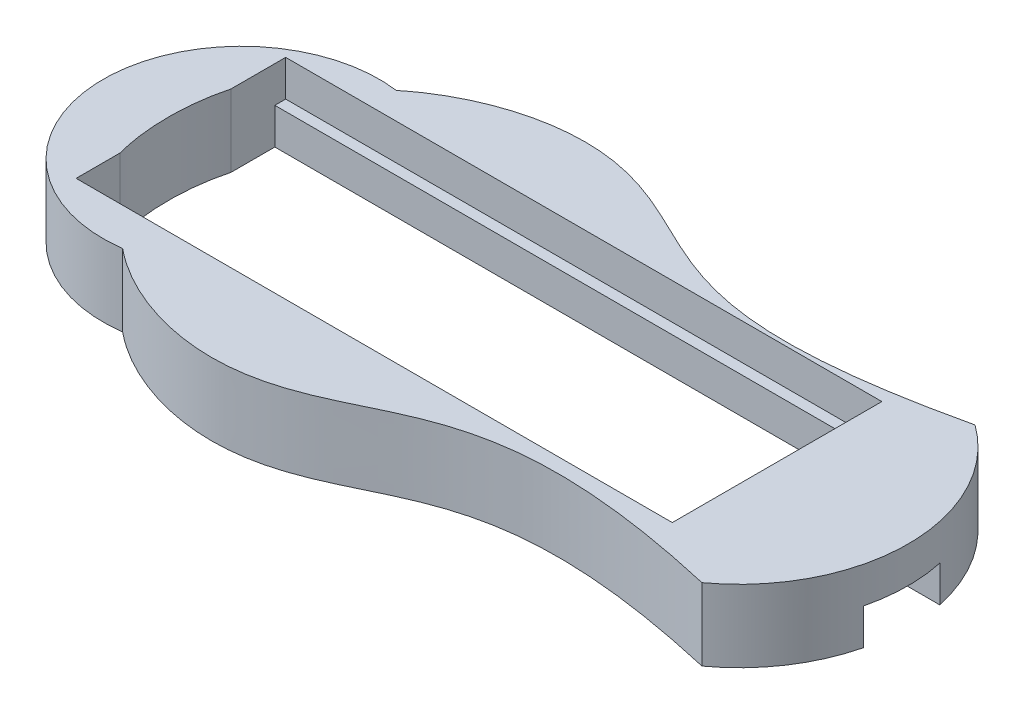
from build123d import *

# Parameters (mm, degrees)
BOSS_EXTRUDE1_DEPTH = 20
SKETCH4_W           = 165
SKETCH4_H           = 3
CUT_EXTRUDE1_DEPTH  = 10
SKETCH9_W           = 41.41609898
SKETCH9_H           = 20.816936128
CUT_EXTRUDE2_DEPTH  = 10


with BuildPart() as part:
    # Sketch1 → Boss-Extrude1 (new body)
    with BuildSketch(Plane(origin=(0, 0, 0), x_dir=(1, 0, 0), z_dir=(0, 1, 0))):
        with BuildLine():
            add(Edge.make_bspline(
                [(145.295936906, 60.832177948), (44.156138469, 37.635123873), (68.598543861, 81.474917307), (14.861380224, 85.461006577), (-14.944677718, 60.924621218)],
                knots=[0, 0, 0, 0, 0, 1, 1, 1, 1, 1], degree=4))
            ThreePointArc((-14.944677718, 60.924621218), (-58.213287959, 23.039876711), (-14.944677718, -14.844867796))
            add(Edge.make_bspline(
                [(145.295936906, -14.752424526), (44.156138469, 8.444629549), (68.598543861, -35.395163885), (14.861380224, -39.381253155), (-14.944677718, -14.844867796)],
                knots=[0, 0, 0, 0, 0, 1, 1, 1, 1, 1], degree=4))
            ThreePointArc((145.295936906, -14.752424526), (164.569452441, 23.039876711), (145.295936906, 60.832177948))
        make_face()
        with BuildLine():
            Line((-38.21027036, -4.460123289), (-38.21027036, 7.689608728))
            add(Edge.make_bspline(
                [(-38.21027036, 38.390144694), (-42.352238314, 23.039876711), (-38.21027036, 7.689608728)],
                knots=[4.204471846, 4.204471846, 4.204471846, 5.220306115, 5.220306115, 5.220306115], degree=2, weights=[1, 0.873759421, 1]))
            Line((-38.21027036, 38.390144694), (-38.21027036, 50.539876711))
            Line((-38.21027036, 50.539876711), (126.78972964, 50.539876711))
            Line((126.78972964, 50.539876711), (126.78972964, -4.460123289))
            Line((126.78972964, -4.460123289), (-38.21027036, -4.460123289))
        make_face(mode=Mode.SUBTRACT)
    extrude(amount=BOSS_EXTRUDE1_DEPTH)

    # Sketch4 → Cut-Extrude1 (cut)
    with BuildSketch(Plane(origin=(0, 20, 0), x_dir=(1, 0, 0), z_dir=(0, 1, 0))):
        with Locations((44.28972964, 52.039876711)):
            Rectangle(SKETCH4_W, SKETCH4_H)
    extrude(amount=-CUT_EXTRUDE1_DEPTH, mode=Mode.SUBTRACT)

    # Sketch9 → Cut-Extrude2 (cut)
    with BuildSketch(Plane.XZ):
        with Locations((147.49777913, -22.403788733)):
            Rectangle(SKETCH9_W, SKETCH9_H)
    extrude(amount=-CUT_EXTRUDE2_DEPTH, mode=Mode.SUBTRACT)


solid = part.part
